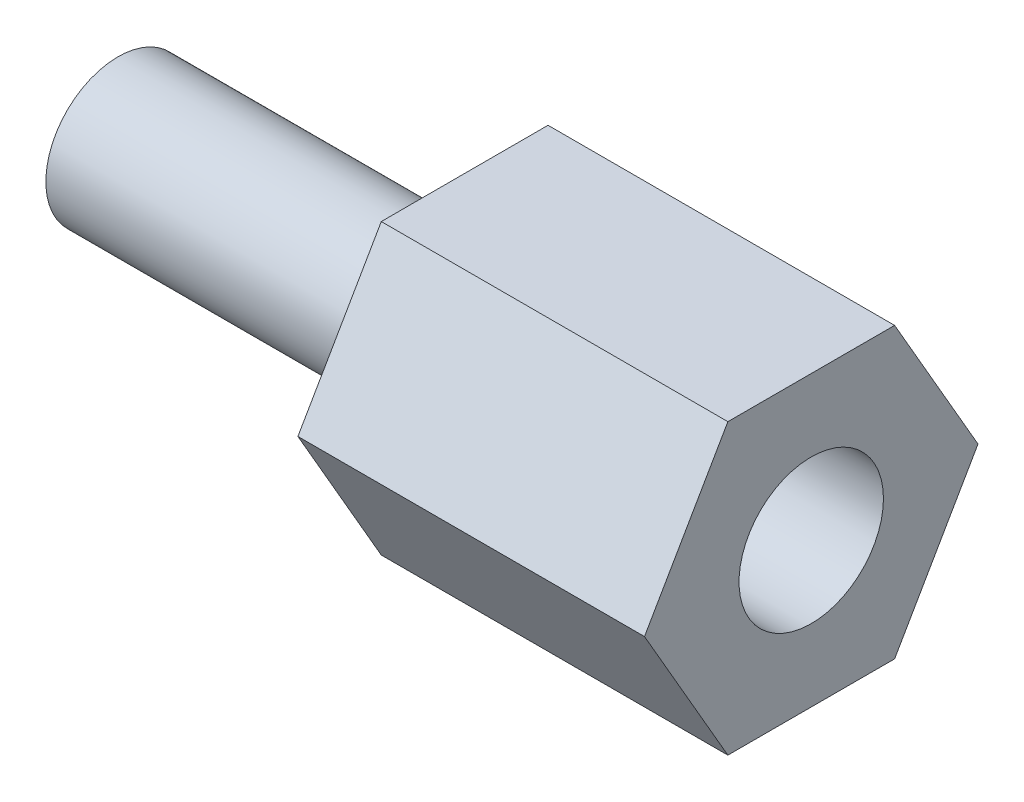
from build123d import *

# Parameters (mm, degrees)
SKETCH1_R           = 1.25
BOSS_EXTRUDE1_DEPTH = 6
SKETCH2_R           = 1.25
BOSS_EXTRUDE2_DEPTH = 6


with BuildPart() as part:
    # Sketch1 → Boss-Extrude1 (new body)
    with BuildSketch(Plane(origin=(0, 0, 0), x_dir=(0, 0, -1), z_dir=(1, 0, 0))):
        Circle(SKETCH1_R)
    extrude(amount=-BOSS_EXTRUDE1_DEPTH)


with BuildPart() as body_2:
    # Sketch2 → Boss-Extrude2 (new body)
    with BuildSketch(Plane(origin=(0, 0, 0), x_dir=(0, 0, -1), z_dir=(1, 0, 0))):
        Polygon((2.886751346, 0), (1.443375673, 2.5), (-1.443375673, 2.5), (-2.886751346, 0), (-1.443375673, -2.5), (1.443375673, -2.5), align=None)
        Circle(SKETCH2_R, mode=Mode.SUBTRACT)
    extrude(amount=BOSS_EXTRUDE2_DEPTH)


solid = Compound([part.part, body_2.part])
